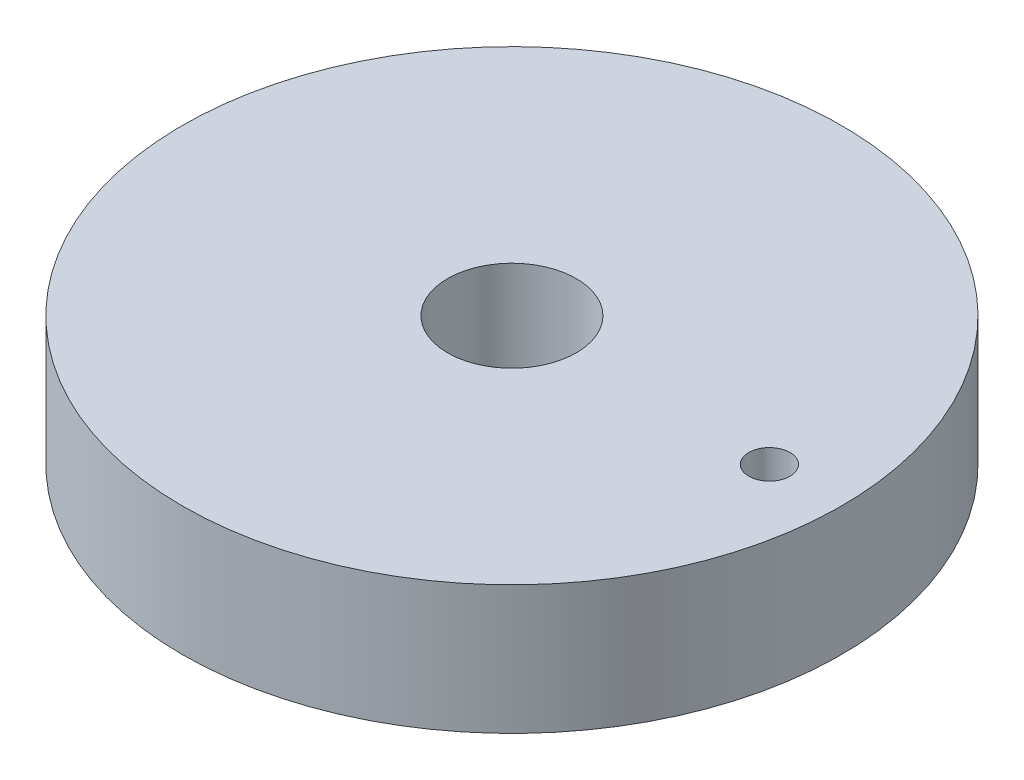
from build123d import *

# Parameters (mm, degrees)
SKETCH_1_R      = 25.6
SKETCH_1_R_2    = 1.6
SKETCH_1_R_3    = 5
EXTRUDE_1_DEPTH = 10


with BuildPart() as part:
    # ｽｹｯﾁ1 → ﾎﾞｽ - 押し出し1 (new body)
    with BuildSketch(Plane(origin=(0, 0, 0), x_dir=(1, 0, 0), z_dir=(0, 1, 0))):
        with Locations(Location((0, 0, 0), (0, 0, 270))):
            Circle(SKETCH_1_R)
        with Locations(Location((20, 0, 0), (0, 0, 270))):
            Circle(SKETCH_1_R_2, mode=Mode.SUBTRACT)
        with Locations(Location((0, 0, 0), (0, 0, 270))):
            Circle(SKETCH_1_R_3, mode=Mode.SUBTRACT)
    extrude(amount=EXTRUDE_1_DEPTH)


solid = part.part
